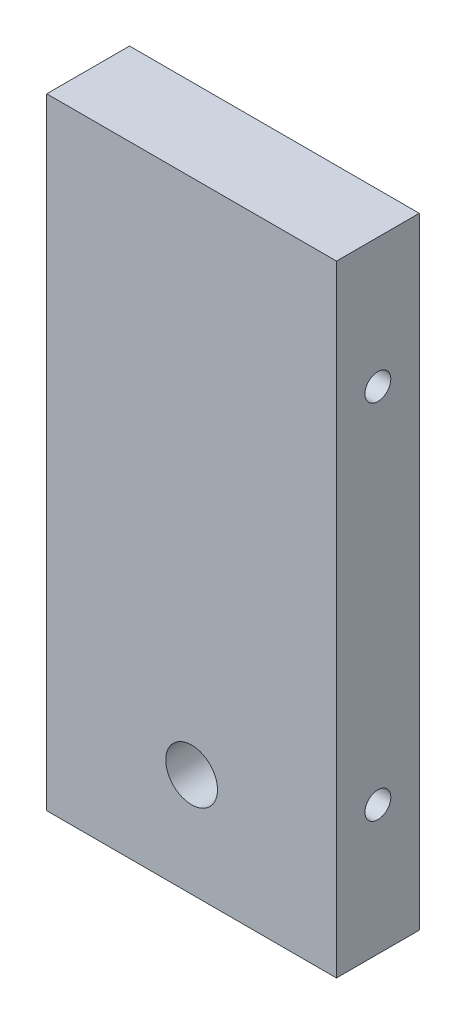
from build123d import *

# Parameters (mm, degrees)
SKETCH_1_W          = 28
SKETCH_1_H          = 60
EXTRUDE_1_DEPTH     = 8
SKETCH_2_R          = 2.5
CUT_EXTRUDE_1_DEPTH = 67.693328002
M3X0_5_1_D          = 2.5
M3X0_5_1_DEPTH      = 7.5
M3X0_5_1_TIP        = 0.751075774
M3X0_5_2_D          = 2.5
M3X0_5_2_DEPTH      = 7.5
M3X0_5_2_TIP        = 0.751075774


with BuildPart() as part:
    # ｽｹｯﾁ1 → ﾎﾞｽ - 押し出し1 (new body)
    with BuildSketch(Plane.XY):
        with Locations((14, 30)):
            Rectangle(SKETCH_1_W, SKETCH_1_H)
    extrude(amount=EXTRUDE_1_DEPTH)

    # ｽｹｯﾁ2 → ｶｯﾄ - 押し出し1 (cut, through all)
    with BuildSketch(Plane.XY.offset(8)):
        with Locations((14, 10)):
            Circle(SKETCH_2_R)
    extrude(amount=-CUT_EXTRUDE_1_DEPTH, mode=Mode.SUBTRACT)

    # M3x0.5 ねじ穴1
    with Locations(Plane(origin=(0, 47.5, 4), x_dir=(0, 0, -1), z_dir=(-1, 0, 0))):
        with Locations((0, 0), (0, 35)):
            Hole(M3X0_5_1_D / 2, depth=M3X0_5_1_DEPTH)
            with Locations((0, 0, -(M3X0_5_1_DEPTH + M3X0_5_1_TIP / 2))):  # 118° drill point
                Cone(0, M3X0_5_1_D / 2, M3X0_5_1_TIP, mode=Mode.SUBTRACT)

    # M3x0.5 ねじ穴2
    with Locations(Plane(origin=(28, 47.5, 4), x_dir=(0, 0, 1), z_dir=(1, 0, 0))):
        with Locations((0, 0), (0, 35)):
            Hole(M3X0_5_2_D / 2, depth=M3X0_5_2_DEPTH)
            with Locations((0, 0, -(M3X0_5_2_DEPTH + M3X0_5_2_TIP / 2))):  # 118° drill point
                Cone(0, M3X0_5_2_D / 2, M3X0_5_2_TIP, mode=Mode.SUBTRACT)


solid = part.part
